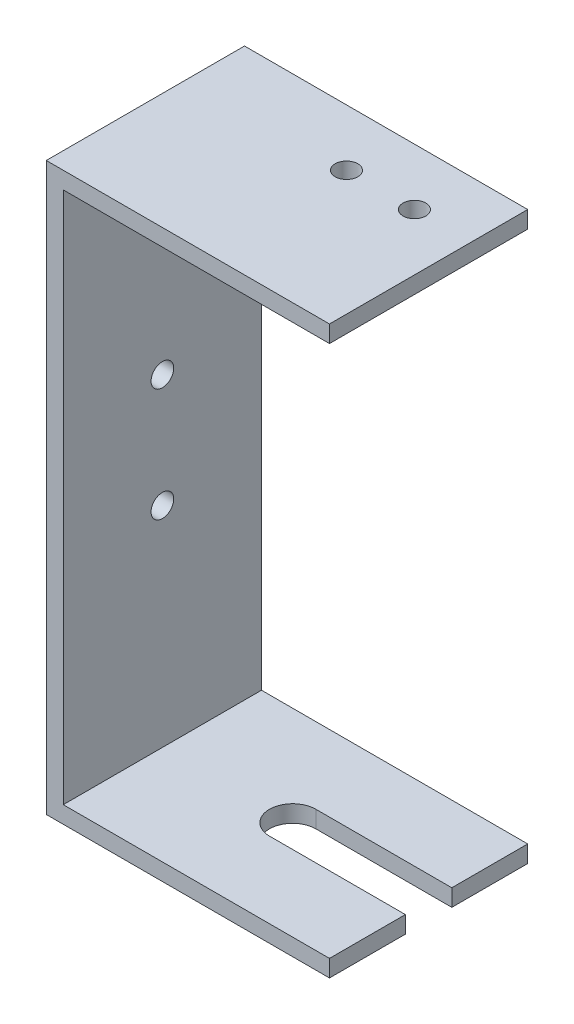
from build123d import *

# Parameters (mm, degrees)
BOSS_EXTRUDE1_DEPTH = 35
CUT_EXTRUDE1_REACH  = 119.154
CUT_EXTRUDE2_REACH  = 119.154
SKETCH3_R           = 2
CUT_EXTRUDE3_REACH  = 119.154
SKETCH4_R           = 2


with BuildPart() as part:
    # Sketch1 → Boss-Extrude1 (new body)
    with BuildSketch(Plane.XY):
        Polygon((0, 0), (-50, 0), (-50, 100), (0, 100), (0, 97), (-47, 97), (-47, 3), (0, 3), align=None)
    extrude(amount=BOSS_EXTRUDE1_DEPTH)

    # Sketch2 → Cut-Extrude1 (cut, up to next)
    with BuildSketch(Plane.XZ, mode=Mode.PRIVATE) as cut_extrude1_sk1:
        with BuildLine():
            Line((0, 13.4), (-24, 13.4))
            ThreePointArc((-24, 13.4), (-28.1, 17.5), (-24, 21.6))
            Line((-24, 21.6), (0, 21.6))
            Line((0, 21.6), (0, 13.4))
        make_face()
    cut_extrude1_tool1 = extrude(cut_extrude1_sk1.sketch, amount=-CUT_EXTRUDE1_REACH, mode=Mode.PRIVATE) & part.part
    add(cut_extrude1_tool1.solids().sort_by_distance((-13.625448, 0, 17.5))[0], mode=Mode.SUBTRACT)

    # Sketch3 → Cut-Extrude2 (cut, up to next)
    with BuildSketch(Plane(origin=(0, 100, 0), x_dir=(1, 0, 0), z_dir=(0, 1, 0)), mode=Mode.PRIVATE) as cut_extrude2_sk1:
        with Locations(Location((-22, -10, 0), (0, 0, 270))):
            Circle(SKETCH3_R)
    cut_extrude2_tool1 = extrude(cut_extrude2_sk1.sketch, amount=-CUT_EXTRUDE2_REACH, mode=Mode.PRIVATE) & part.part
    # Sketch3 → Cut-Extrude2 (cut, up to next)
    with BuildSketch(Plane(origin=(0, 100, 0), x_dir=(1, 0, 0), z_dir=(0, 1, 0)), mode=Mode.PRIVATE) as cut_extrude2_sk2:
        with Locations(Location((-10, -10, 0), (0, 0, 270))):
            Circle(SKETCH3_R)
    cut_extrude2_tool2 = extrude(cut_extrude2_sk2.sketch, amount=-CUT_EXTRUDE2_REACH, mode=Mode.PRIVATE) & part.part
    add(cut_extrude2_tool1.solids().sort_by_distance((-22, 100, 10))[0], mode=Mode.SUBTRACT)
    add(cut_extrude2_tool2.solids().sort_by_distance((-10, 100, 10))[0], mode=Mode.SUBTRACT)

    # Sketch4 → Cut-Extrude3 (cut, up to next)
    with BuildSketch(Plane.ZY.offset(50), mode=Mode.PRIVATE) as cut_extrude3_sk1:
        with Locations((17.5, 60)):
            Circle(SKETCH4_R)
    cut_extrude3_tool1 = extrude(cut_extrude3_sk1.sketch, amount=-CUT_EXTRUDE3_REACH, mode=Mode.PRIVATE) & part.part
    # Sketch4 → Cut-Extrude3 (cut, up to next)
    with BuildSketch(Plane.ZY.offset(50), mode=Mode.PRIVATE) as cut_extrude3_sk2:
        with Locations((17.5, 40)):
            Circle(SKETCH4_R)
    cut_extrude3_tool2 = extrude(cut_extrude3_sk2.sketch, amount=-CUT_EXTRUDE3_REACH, mode=Mode.PRIVATE) & part.part
    add(cut_extrude3_tool1.solids().sort_by_distance((-50, 60, 17.5))[0], mode=Mode.SUBTRACT)
    add(cut_extrude3_tool2.solids().sort_by_distance((-50, 40, 17.5))[0], mode=Mode.SUBTRACT)


solid = part.part
